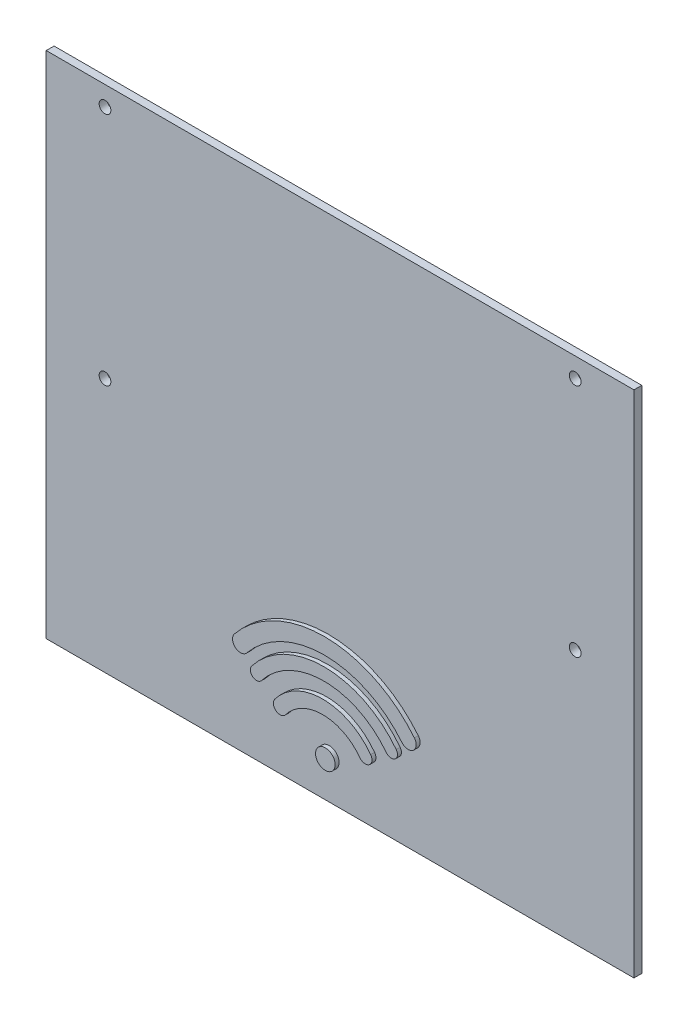
from build123d import *

# Parameters (mm, degrees)
SKETCH1_W           = 150
SKETCH1_H           = 130
SKETCH1_R           = 1.5
BOSS_EXTRUDE1_DEPTH = 2
SKETCH3_R           = 2.5
BOSS_EXTRUDE2_DEPTH = 1


with BuildPart() as part:
    # Sketch1 → Boss-Extrude1 (new body)
    with BuildSketch(Plane.XY):
        with Locations((-1.886747415, -24.010339734)):
            Rectangle(SKETCH1_W, SKETCH1_H)
        with Locations((-61.886747415, 35.989660266)):
            Circle(SKETCH1_R, mode=Mode.SUBTRACT)
        with Locations((58.113252585, 35.989660266)):
            Circle(SKETCH1_R, mode=Mode.SUBTRACT)
        with Locations((-61.886747415, -24.010339734)):
            Circle(SKETCH1_R, mode=Mode.SUBTRACT)
        with Locations((58.113252585, -24.010339734)):
            Circle(SKETCH1_R, mode=Mode.SUBTRACT)
    extrude(amount=BOSS_EXTRUDE1_DEPTH)

    # Sketch3 → Boss-Extrude2 (add)
    with BuildSketch(Plane.XY.offset(2)):
        with Locations((-4.64809573, -79.010339734)):
            Circle(SKETCH3_R)
        with BuildLine():
            ThreePointArc((6.923235342, -72.232974628), (-5.323558957, -66.063152089), (-17.570353256, -72.232974628))
            ThreePointArc((-17.570353256, -72.232974628), (-17.211884144, -74.638125217), (-14.806733555, -74.279656105))
            ThreePointArc((-14.806733555, -74.279656105), (-5.323558957, -69.502119801), (4.159615641, -74.279656105))
            ThreePointArc((4.159615641, -74.279656105), (6.56476623, -74.638125217), (6.923235342, -72.232974628))
        make_face()
        with BuildLine():
            ThreePointArc((18.078397342, -62.968741701), (-4.900318567, -52.033991798), (-27.879034477, -62.968741701))
            ThreePointArc((-27.879034477, -62.968741701), (-27.581012613, -65.854503882), (-24.695250433, -65.556482018))
            ThreePointArc((-24.695250433, -65.556482018), (-4.900318567, -56.136781189), (14.894613298, -65.556482018))
            ThreePointArc((14.894613298, -65.556482018), (17.780375479, -65.854503882), (18.078397342, -62.968741701))
        make_face()
        with BuildLine():
            ThreePointArc((13.443037293, -67.850100594), (-5.007901344, -58.749928764), (-23.458839981, -67.850100594))
            ThreePointArc((-23.458839981, -67.850100594), (-23.164962626, -70.080553699), (-20.934509521, -69.786676345))
            ThreePointArc((-20.934509521, -69.786676345), (-5.007901344, -61.931527405), (10.918706833, -69.786676345))
            ThreePointArc((10.918706833, -69.786676345), (13.149159939, -70.080553699), (13.443037293, -67.850100594))
        make_face()
    extrude(amount=BOSS_EXTRUDE2_DEPTH)


solid = part.part
